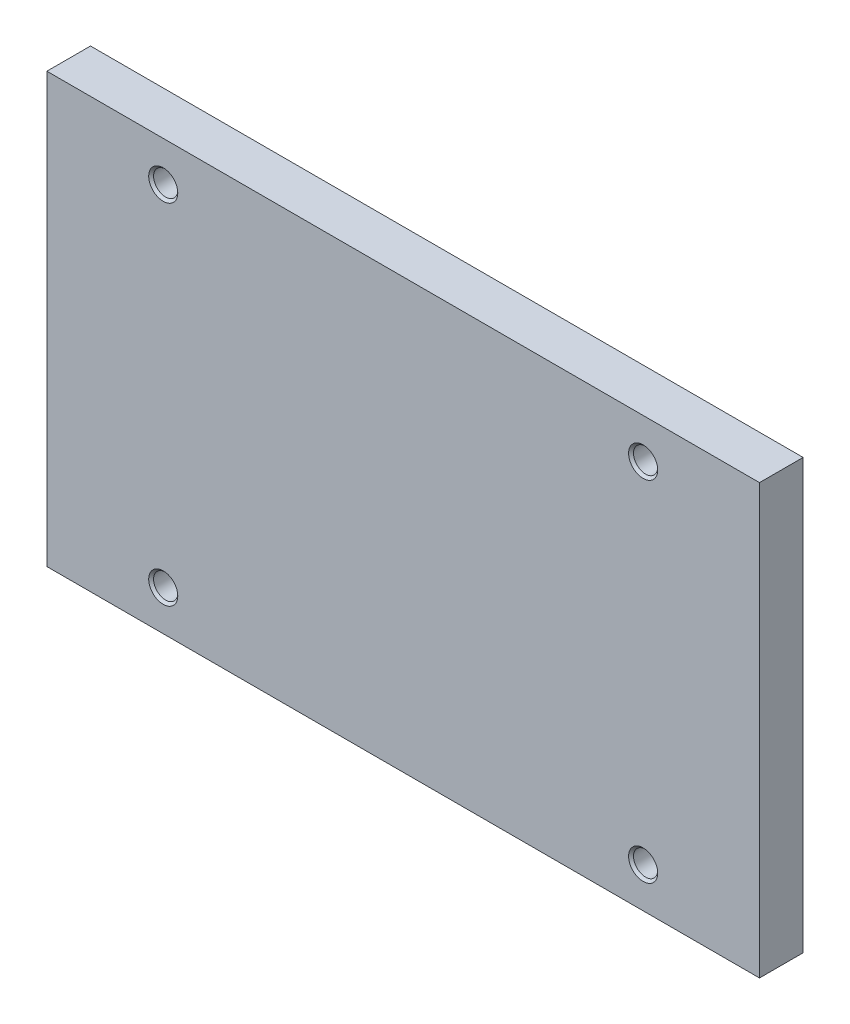
from build123d import *

# Parameters (mm, degrees)
SKETCH_1_W        = 196
SKETCH_1_H        = 118
EXTRUDE_1_DEPTH   = 12
HOLE_WIZARD_M61_D = 6.647
HOLE_WIZARD_M62_D = 6.647
CHAMFER_1_SIZE    = 0.6765


with BuildPart() as part:
    # Эскиз1 → Бобышка-Вытянуть1 (new body)
    with BuildSketch(Plane.XY.offset(12)):
        Rectangle(SKETCH_1_W, SKETCH_1_H)
    extrude(amount=-EXTRUDE_1_DEPTH)

    # Отверстие с зазором M61 (through all)
    with Locations(Plane(origin=(0, 0, 0), x_dir=(-1, 0, 0), z_dir=(0, 0, -1))):
        with Locations((-66, -48)):
            Hole(HOLE_WIZARD_M61_D / 2)

    # Отверстие с зазором M62 (through all)
    with Locations(Plane.XY.offset(12)):
        with Locations((-66, 48), (-66, -48), (66, 48)):
            Hole(HOLE_WIZARD_M62_D / 2)

    # Фаска1
    chamfer_1_edges = [part.edges().sort_by_distance(p)[0] for p in [
        (62.6765, -48, 0),
        (62.6765, -48, 12),
        (69.3235, 48, 12),
        (69.3235, 48, 0),
        (-62.6765, -48, 12),
        (-62.6765, -48, 0),
        (-62.6765, 48, 12),
        (-62.6765, 48, 0),
    ]]
    chamfer(chamfer_1_edges, length=CHAMFER_1_SIZE)


solid = part.part
